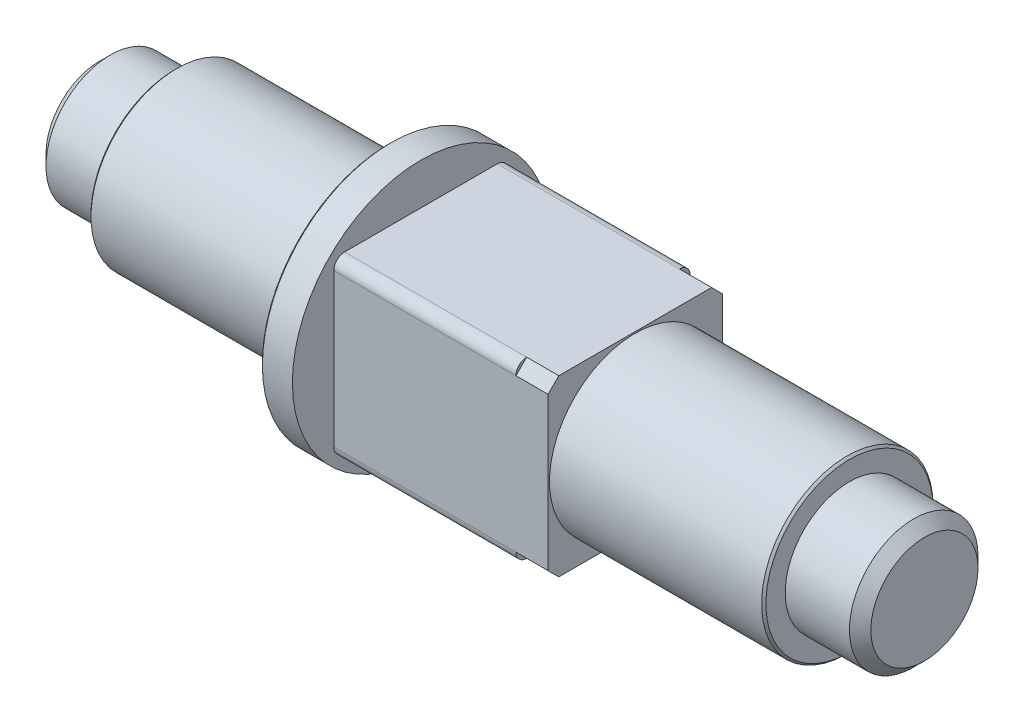
from build123d import *

# Parameters (mm, degrees)
EXTRUDE_1_DEPTH     = 10
CUT_EXTRUDE_2_DEPTH = 1.5


with BuildPart() as part:
    # 草图1 → 旋转1 (revolve)
    with BuildSketch(Plane.XY, mode=Mode.PRIVATE) as revolve_1_sk:
        Polygon((0, 0), (0, 2.5), (0.5, 3), (3.5, 3), (3.5, 3.9), (3.6, 4), (13.5, 4), (13.5, 5.9), (13.6, 6), (15, 6), (15, 0), align=None)
    revolve(revolve_1_sk.sketch.rotate(Axis((15, 0, 0), (-1, 0, 0)), 90), axis=Axis((15, 0, 0), (-1, 0, 0)))

    # 草图2 → 凸台-拉伸1 (add)
    with BuildSketch(Plane(origin=(15, 0, 0), x_dir=(0, 0, -1), z_dir=(1, 0, 0))):
        with BuildLine():
            Line((-3.565863992, 4.065863992), (3.565863992, 4.065863992))
            ThreePointArc((3.565863992, 4.065863992), (3.919417382, 3.919417382), (4.065863992, 3.565863992))
            Line((4.065863992, 3.565863992), (4.065863992, -3.565863992))
            ThreePointArc((4.065863992, -3.565863992), (3.919417382, -3.919417382), (3.565863992, -4.065863992))
            Line((3.565863992, -4.065863992), (-3.565863992, -4.065863992))
            ThreePointArc((-3.565863992, -4.065863992), (-3.919417382, -3.919417382), (-4.065863992, -3.565863992))
            Line((-4.065863992, -3.565863992), (-4.065863992, 3.565863992))
            ThreePointArc((-4.065863992, 3.565863992), (-3.919417382, 3.919417382), (-3.565863992, 4.065863992))
        make_face()
    extrude(amount=EXTRUDE_1_DEPTH)

    # 草图3 → 切除-拉伸2 (cut)
    with BuildSketch(Plane(origin=(25, 0, 0), x_dir=(0, 0, -1), z_dir=(1, 0, 0))):
        Polygon((-4.065863992, 3.565863992), (-3.565863992, 4.065863992), (-4.065863992, 4.065863992), align=None)
        Polygon((3.565863992, 4.065863992), (4.065863992, 3.565863992), (4.065863992, 4.065863992), align=None)
        Polygon((-4.065863992, -3.565863992), (-3.565863992, -4.065863992), (-4.065863992, -4.065863992), align=None)
        Polygon((3.565863992, -4.065863992), (4.065863992, -3.565863992), (4.065863992, -4.065863992), align=None)
    extrude(amount=-CUT_EXTRUDE_2_DEPTH, mode=Mode.SUBTRACT)

    # 草图5 → 旋转2 (revolve)
    with BuildSketch(Plane.XY, mode=Mode.PRIVATE) as revolve_2_sk:
        Polygon((35, 3.9), (35, 3), (38, 3), (38.5, 2.5), (38.5, 0), (25, 0), (25, 4), (34.9, 4), align=None)
    revolve(revolve_2_sk.sketch.rotate(Axis((38.5, 0, 0), (-1, 0, 0)), 90), axis=Axis((38.5, 0, 0), (-1, 0, 0)))


solid = part.part
